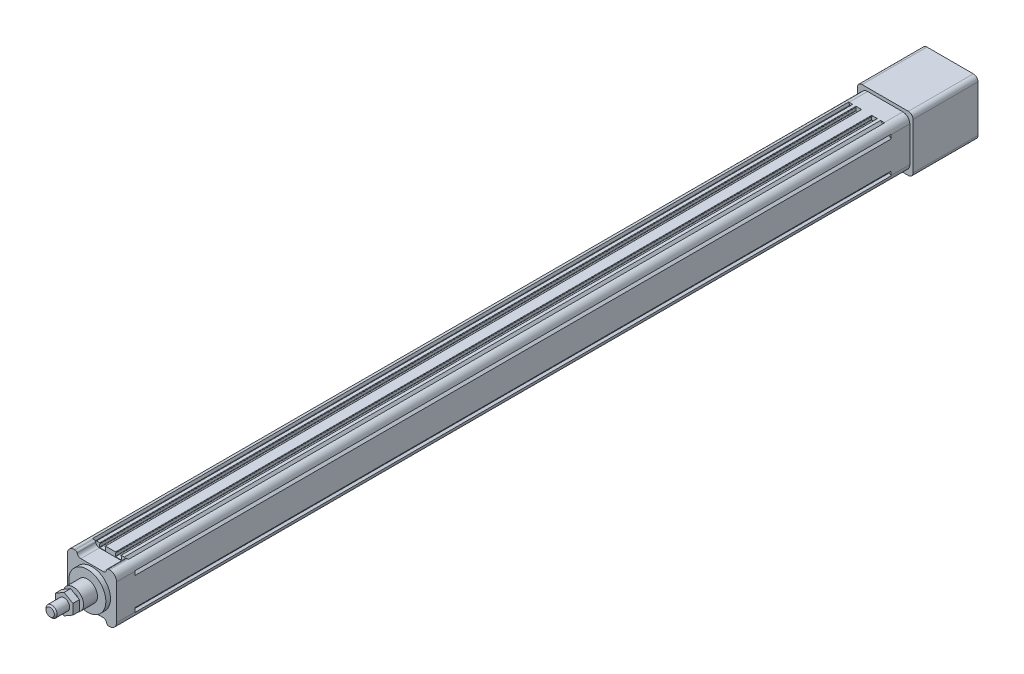
from build123d import *

# Parameters (mm, degrees)
SKETCH_1_R             = 2.1
EXTRUDE_1_DEPTH        = 815
EXTRUDE_2_DEPTH        = 20
SKETCH_7_R             = 20
EXTRUDE_3_DEPTH        = 5
SKETCH_9_R             = 11
EXTRUDE_4_DEPTH        = 15
SKETCH_10_R            = 6
EXTRUDE_5_DEPTH        = 25
EXTRUDE_START          = 20
EXTRUDE_6_DEPTH        = 20
EXTRUDE_7_DEPTH        = 70
SKETCH_14_R            = 19
CUT_EXTRUDE_2_DEPTH    = 70
HOLE_WIZARD_M6_1_D     = 5
HOLE_WIZARD_M6_1_DEPTH = 15
HOLE_WIZARD_M6_1_TIP   = 1.502151548
CHAMFER_1_SIZE         = 1.5
EXTRUDE_START_2        = 3
EXTRUDE_8_DEPTH        = 7


with BuildPart() as part:
    # 草图1 → 凸台-拉伸1 (new body)
    with BuildSketch(Plane.XY):
        with BuildLine():
            Line((-18.2, 24), (-19.443439638, 26.486879276))
            ThreePointArc((-19.443439638, 26.486879276), (-24.303300859, 24.303300859), (-26.486879276, 19.443439638))
            Line((-26.486879276, 19.443439638), (-24, 18.2))
            Line((-24, 18.2), (-24, 17.1))
            Line((-24, 17.1), (-26.5, 15))
            Line((-26.5, 15), (-26.5, -15))
            Line((-26.5, -15), (-24, -17.1))
            Line((-24, -17.1), (-24, -18.2))
            Line((-24, -18.2), (-26.486879276, -19.443439638))
            ThreePointArc((-26.486879276, -19.443439638), (-24.303300859, -24.303300859), (-19.443439638, -26.486879276))
            Line((-19.443439638, -26.486879276), (-18.2, -24))
            Line((-18.2, -24), (-17.1, -24))
            Line((-17.1, -24), (-15, -26.5))
            Line((-15, -26.5), (-11.65, -26.5))
            ThreePointArc((-11.65, -26.5), (-11.367157288, -26.382842712), (-11.25, -26.1))
            Line((-11.25, -26.1), (-11.25, -25.6))
            ThreePointArc((-11.25, -25.6), (-11.367157288, -25.317157288), (-11.65, -25.2))
            Line((-11.65, -25.2), (-11.75, -25.2))
            Line((-11.75, -25.2), (-11.75, -22.4))
            ThreePointArc((-11.75, -22.4), (-11.632842712, -22.117157288), (-11.35, -22))
            Line((-11.35, -22), (-5.65, -22))
            ThreePointArc((-5.65, -22), (-5.367157288, -22.117157288), (-5.25, -22.4))
            Line((-5.25, -22.4), (-5.25, -25.2))
            Line((-5.25, -25.2), (-5.35, -25.2))
            ThreePointArc((-5.35, -25.2), (-5.632842712, -25.317157288), (-5.75, -25.6))
            Line((-5.75, -25.6), (-5.75, -26.1))
            ThreePointArc((-5.75, -26.1), (-5.632842712, -26.382842712), (-5.35, -26.5))
            Line((-5.35, -26.5), (5.35, -26.5))
            ThreePointArc((5.35, -26.5), (5.632842712, -26.382842712), (5.75, -26.1))
            Line((5.75, -26.1), (5.75, -25.6))
            ThreePointArc((5.75, -25.6), (5.632842712, -25.317157288), (5.35, -25.2))
            Line((5.35, -25.2), (5.25, -25.2))
            Line((5.25, -25.2), (5.25, -22.4))
            ThreePointArc((5.25, -22.4), (5.367157288, -22.117157288), (5.65, -22))
            Line((5.65, -22), (11.35, -22))
            ThreePointArc((11.35, -22), (11.632842712, -22.117157288), (11.75, -22.4))
            Line((11.75, -22.4), (11.75, -25.2))
            Line((11.75, -25.2), (11.65, -25.2))
            ThreePointArc((11.65, -25.2), (11.367157288, -25.317157288), (11.25, -25.6))
            Line((11.25, -25.6), (11.25, -26.1))
            ThreePointArc((11.25, -26.1), (11.367157288, -26.382842712), (11.65, -26.5))
            Line((11.65, -26.5), (15, -26.5))
            Line((15, -26.5), (17.1, -24))
            Line((17.1, -24), (18.2, -24))
            Line((18.2, -24), (19.443439638, -26.486879276))
            ThreePointArc((19.443439638, -26.486879276), (24.303300859, -24.303300859), (26.486879276, -19.443439638))
            Line((26.486879276, -19.443439638), (24, -18.2))
            Line((24, -18.2), (24, -17.1))
            Line((24, -17.1), (26.5, -15))
            Line((26.5, -15), (26.5, 15))
            Line((26.5, 15), (24, 17.1))
            Line((24, 17.1), (24, 18.2))
            Line((24, 18.2), (26.486879276, 19.443439638))
            ThreePointArc((26.486879276, 19.443439638), (24.303300859, 24.303300859), (19.443439638, 26.486879276))
            Line((19.443439638, 26.486879276), (18.2, 24))
            Line((18.2, 24), (17.1, 24))
            Line((17.1, 24), (15, 26.5))
            Line((15, 26.5), (11.65, 26.5))
            ThreePointArc((11.65, 26.5), (11.367157288, 26.382842712), (11.25, 26.1))
            Line((11.25, 26.1), (11.25, 25.6))
            ThreePointArc((11.25, 25.6), (11.367157288, 25.317157288), (11.65, 25.2))
            Line((11.65, 25.2), (11.75, 25.2))
            Line((11.75, 25.2), (11.75, 22.4))
            ThreePointArc((11.75, 22.4), (11.632842712, 22.117157288), (11.35, 22))
            Line((11.35, 22), (5.65, 22))
            ThreePointArc((5.65, 22), (5.367157288, 22.117157288), (5.25, 22.4))
            Line((5.25, 22.4), (5.25, 25.2))
            Line((5.25, 25.2), (5.35, 25.2))
            ThreePointArc((5.35, 25.2), (5.632842712, 25.317157288), (5.75, 25.6))
            Line((5.75, 25.6), (5.75, 26.1))
            ThreePointArc((5.75, 26.1), (5.632842712, 26.382842712), (5.35, 26.5))
            Line((5.35, 26.5), (-5.35, 26.5))
            ThreePointArc((-5.35, 26.5), (-5.632842712, 26.382842712), (-5.75, 26.1))
            Line((-5.75, 26.1), (-5.75, 25.6))
            ThreePointArc((-5.75, 25.6), (-5.632842712, 25.317157288), (-5.35, 25.2))
            Line((-5.35, 25.2), (-5.25, 25.2))
            Line((-5.25, 25.2), (-5.25, 22.4))
            ThreePointArc((-5.25, 22.4), (-5.367157288, 22.117157288), (-5.65, 22))
            Line((-5.65, 22), (-11.35, 22))
            ThreePointArc((-11.35, 22), (-11.632842712, 22.117157288), (-11.75, 22.4))
            Line((-11.75, 22.4), (-11.75, 25.2))
            Line((-11.75, 25.2), (-11.65, 25.2))
            ThreePointArc((-11.65, 25.2), (-11.367157288, 25.317157288), (-11.25, 25.6))
            Line((-11.25, 25.6), (-11.25, 26.1))
            ThreePointArc((-11.25, 26.1), (-11.367157288, 26.382842712), (-11.65, 26.5))
            Line((-11.65, 26.5), (-15, 26.5))
            Line((-15, 26.5), (-17.1, 24))
            Line((-17.1, 24), (-18.2, 24))
        make_face()
        with Locations((19, 19)):
            Circle(SKETCH_1_R, mode=Mode.SUBTRACT)
        with Locations((19, -19)):
            Circle(SKETCH_1_R, mode=Mode.SUBTRACT)
        with Locations((-19, -19)):
            Circle(SKETCH_1_R, mode=Mode.SUBTRACT)
        with Locations((-19, 19)):
            Circle(SKETCH_1_R, mode=Mode.SUBTRACT)
        with BuildLine():
            Line((19.773719933, 3), (23.3, 3))
            Line((23.3, 3), (23.3, -3))
            Line((23.3, -3), (19.773719933, -3))
            ThreePointArc((19.773719933, -3), (0, -20), (-19.773719933, -3))
            Line((-19.773719933, -3), (-23.3, -3))
            Line((-23.3, -3), (-23.3, 3))
            Line((-23.3, 3), (-19.773719933, 3))
            ThreePointArc((-19.773719933, 3), (0, 20), (19.773719933, 3))
        make_face(mode=Mode.SUBTRACT)
    extrude(amount=EXTRUDE_1_DEPTH)

    # 草图6 → 凸台-拉伸2 (add)
    with BuildSketch(Plane.XY.offset(815)):
        with BuildLine():
            Line((-26.5, -19), (-26.5, 19))
            ThreePointArc((-26.5, 19), (-24.303300859, 24.303300859), (-19, 26.5))
            Line((-19, 26.5), (-17.916079783, 26.5))
            ThreePointArc((-17.916079783, 26.5), (-16.625085334, 26.027525232), (-15.944053189, 24.833333333))
            ThreePointArc((-15.944053189, 24.833333333), (-14.581988897, 22.444949537), (-12, 21.5))
            Line((-12, 21.5), (12, 21.5))
            ThreePointArc((12, 21.5), (14.581988897, 22.444949537), (15.944053189, 24.833333333))
            ThreePointArc((15.944053189, 24.833333333), (16.625085334, 26.027525232), (17.916079783, 26.5))
            Line((17.916079783, 26.5), (19, 26.5))
            ThreePointArc((19, 26.5), (24.303300859, 24.303300859), (26.5, 19))
            Line((26.5, 19), (26.5, -19))
            ThreePointArc((26.5, -19), (24.303300859, -24.303300859), (19, -26.5))
            Line((19, -26.5), (17.916079783, -26.5))
            ThreePointArc((17.916079783, -26.5), (16.625085334, -26.027525232), (15.944053189, -24.833333333))
            ThreePointArc((15.944053189, -24.833333333), (14.581988897, -22.444949537), (12, -21.5))
            Line((12, -21.5), (-12, -21.5))
            ThreePointArc((-12, -21.5), (-14.581988897, -22.444949537), (-15.944053189, -24.833333333))
            ThreePointArc((-15.944053189, -24.833333333), (-16.625085334, -26.027525232), (-17.916079783, -26.5))
            Line((-17.916079783, -26.5), (-19, -26.5))
            ThreePointArc((-19, -26.5), (-24.303300859, -24.303300859), (-26.5, -19))
        make_face()
    extrude(amount=EXTRUDE_2_DEPTH)

    # 草图7 → 凸台-拉伸3 (add)
    with BuildSketch(Plane.XY.offset(835)):
        Circle(SKETCH_7_R)
    extrude(amount=EXTRUDE_3_DEPTH)

    # 草图9 → 凸台-拉伸4 (add)
    with BuildSketch(Plane.XY.offset(840)):
        Circle(SKETCH_9_R)
    extrude(amount=EXTRUDE_4_DEPTH)

    # 草图10 → 凸台-拉伸5 (add)
    with BuildSketch(Plane.XY.offset(855)):
        Circle(SKETCH_10_R)
    extrude(amount=EXTRUDE_5_DEPTH)

    # 草图11 → 凸台-拉伸6 (add)
    with BuildSketch(Plane(origin=(0, 0, 0), x_dir=(-1, 0, 0), z_dir=(0, 0, -1)).offset(EXTRUDE_START)):
        with BuildLine():
            Line((-19, -26.5), (19, -26.5))
            ThreePointArc((19, -26.5), (24.303300859, -24.303300859), (26.5, -19))
            Line((26.5, -19), (26.5, 19))
            ThreePointArc((26.5, 19), (24.303300859, 24.303300859), (19, 26.5))
            Line((19, 26.5), (-19, 26.5))
            ThreePointArc((-19, 26.5), (-24.303300859, 24.303300859), (-26.5, 19))
            Line((-26.5, 19), (-26.5, -19))
            ThreePointArc((-26.5, -19), (-24.303300859, -24.303300859), (-19, -26.5))
        make_face()
    extrude(amount=-EXTRUDE_6_DEPTH)

    # 草图12 → 凸台-拉伸7 (add)
    with BuildSketch(Plane(origin=(0, 0, -20), x_dir=(-1, 0, 0), z_dir=(0, 0, -1))):
        with BuildLine():
            Line((-25, -30), (25, -30))
            ThreePointArc((25, -30), (28.535533906, -28.535533906), (30, -25))
            Line((30, -25), (30, 25))
            ThreePointArc((30, 25), (28.535533906, 28.535533906), (25, 30))
            Line((25, 30), (-25, 30))
            ThreePointArc((-25, 30), (-28.535533906, 28.535533906), (-30, 25))
            Line((-30, 25), (-30, -25))
            ThreePointArc((-30, -25), (-28.535533906, -28.535533906), (-25, -30))
        make_face()
    extrude(amount=EXTRUDE_7_DEPTH)

    # 草图14 → 切除-拉伸2 (cut)
    with BuildSketch(Plane(origin=(0, 0, -90), x_dir=(-1, 0, 0), z_dir=(0, 0, -1))):
        Circle(SKETCH_14_R)
    extrude(amount=-CUT_EXTRUDE_2_DEPTH, mode=Mode.SUBTRACT)

    # M6 螺纹孔1
    with Locations(Plane.ZY.offset(26.5)):
        with Locations((825, 11), (825, -11), (-10, 11), (-10, -11)):
            Hole(HOLE_WIZARD_M6_1_D / 2, depth=HOLE_WIZARD_M6_1_DEPTH)
            with Locations((0, 0, -(HOLE_WIZARD_M6_1_DEPTH + HOLE_WIZARD_M6_1_TIP / 2))):  # 118° drill point
                Cone(0, HOLE_WIZARD_M6_1_D / 2, HOLE_WIZARD_M6_1_TIP, mode=Mode.SUBTRACT)

    # 倒角1
    chamfer_1_edges = [part.edges().sort_by_distance(p)[0] for p in [
        (-6, 0, 880),
    ]]
    chamfer(chamfer_1_edges, length=CHAMFER_1_SIZE)

    # 草图17 → 凸台-拉伸8 (add)
    with BuildSketch(Plane.XY.offset(855).offset(EXTRUDE_START_2)):
        Polygon((0, 10.969655115), (-9.5, 5.484827557), (-9.5, -5.484827557), (0, -10.969655115), (9.5, -5.484827557), (9.5, 5.484827557), align=None)
    extrude(amount=EXTRUDE_8_DEPTH)


solid = part.part
